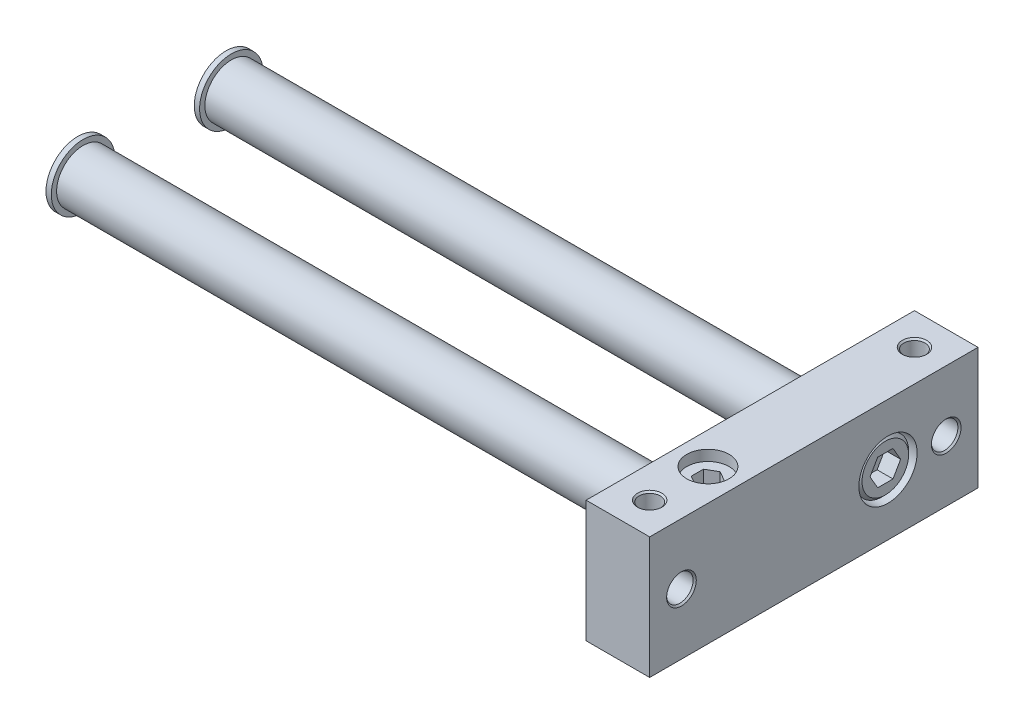
from build123d import *

# Parameters (mm, degrees)
PLATE_SKETCH_W               = 62
PLATE_SKETCH_H               = 23
PLATE_DEPTH                  = 12
TAPPED_HOLE_FACE_D           = 5
TAPPED_HOLE_FACE_CSINK_D     = 5.6
TAPPED_HOLE_FACE_CSINK_ANGLE = 90
RODS_DEPTH                   = 100
RODS_DEPTH_BACK              = 24
RODS_SKETCH_R                = 5
PISTON_SKETCH_R              = 6
PISTON_DEPTH                 = 1
TAPPED_HOLES_TOP_AT_2_COUNT  = 2
TAPPED_HOLES_TOP_AT_2_PITCH  = 50
SHCS_SEAT_SKETCH_R           = 5.5
SHCS_SEAT_DEPTH              = 6.5
SHCS_HEAD_SKETCH_R           = 5
SHCS_HEAD_DEPTH              = 6
SHCS_HEX_DEPTH               = 3
SHCS_CHAM_SIZE               = 0.6
SS_SEAT_SKETCH_R             = 4
SS_SEAT_DEPTH                = 2
SS_HEX_DEPTH                 = 4


with BuildPart() as part:
    # Plate_Sketch → Plate (new body)
    with BuildSketch(Plane(origin=(0, 0, 0), x_dir=(0, 0, -1), z_dir=(1, 0, 0))):
        Rectangle(PLATE_SKETCH_W, PLATE_SKETCH_H)
    extrude(amount=PLATE_DEPTH)

    # Tapped Hole Face (through all)
    with Locations(Plane(origin=(12, 0, 0), x_dir=(0, 0, -1), z_dir=(1, 0, 0))):
        with Locations((-25, 0), (25, 0)):
            CounterSinkHole(TAPPED_HOLE_FACE_D / 2, TAPPED_HOLE_FACE_CSINK_D / 2, counter_sink_angle=TAPPED_HOLE_FACE_CSINK_ANGLE)

    # Rods_Sketch → Rods (add, two sides: drawn at the far end of the back side and taken through both)
    with BuildSketch(Plane.ZY.offset(12).offset(-RODS_DEPTH_BACK)):
        with Locations((-14, 0)):
            Circle(RODS_SKETCH_R)
        with Locations(Location((14, 0, 0), (0, 0, 180))):
            Circle(RODS_SKETCH_R)
    extrude(amount=RODS_DEPTH + RODS_DEPTH_BACK)

    # Piston_Sketch → Piston (add)
    with BuildSketch(Plane.ZY.offset(112)):
        with Locations((-14, 0)):
            Circle(PISTON_SKETCH_R)
        with Locations((14, 0)):
            Circle(PISTON_SKETCH_R)
    extrude(amount=PISTON_DEPTH)

    # Tapped Holes Top Profile → Tapped Holes Top (revolve, cut)
    with BuildSketch(Plane(origin=(6, 11.5, -25), x_dir=(0, 0, 1), z_dir=(1, 0, 0))):
        Polygon((0, 0), (0, 6.499755867), (1.7, 6.2), (1.7, 6), (2, 6), (2, 0.3), (2.3, 0), align=None)
    tapped_holes_top = revolve(axis=Axis((6, 17.85, -25), (0, -1, 0)), mode=Mode.SUBTRACT)

    # Tapped Holes Top at 2: Tapped Holes Top ×2
    with Locations(*[(0, 0, i * TAPPED_HOLES_TOP_AT_2_PITCH) for i in range(1, TAPPED_HOLES_TOP_AT_2_COUNT)]):
        add(tapped_holes_top, mode=Mode.SUBTRACT)

    # Tapped Holes Top Mirror: Tapped Holes Top across plane
    add(tapped_holes_top.mirror(Plane.ZX), mode=Mode.SUBTRACT)

    # Tapped Holes Top Mirror copy 1 sketch → Tapped Holes Top Mirror copy 1 (revolve, cut)
    with BuildSketch(Plane(origin=(6, -11.5, 25), x_dir=(0, 0, 1), z_dir=(1, 0, 0))):
        Polygon((0, 0), (0, -6.499755867), (1.7, -6.2), (1.7, -6), (2, -6), (2, -0.3), (2.3, 0), align=None)
    revolve(axis=Axis((6, -17.85, 25), (0, -1, 0)), mode=Mode.SUBTRACT)

    # SHCS Seat_Sketch → SHCS Seat (cut)
    with BuildSketch(Plane(origin=(12, 0, 0), x_dir=(0, 0, -1), z_dir=(1, 0, 0))):
        with Locations((14, 0)):
            Circle(SHCS_SEAT_SKETCH_R)
    extrude(amount=-SHCS_SEAT_DEPTH, mode=Mode.SUBTRACT)

    # SHCS Head_Sketch → SHCS Head (add)
    with BuildSketch(Plane(origin=(5.5, 0, 0), x_dir=(0, 0, -1), z_dir=(1, 0, 0))):
        with Locations(Location((14, 0, 0), (0, 0, 180))):
            Circle(SHCS_HEAD_SKETCH_R)
    extrude(amount=SHCS_HEAD_DEPTH)

    # SHCS Hex_Sketch → SHCS Hex (cut)
    with BuildSketch(Plane(origin=(11.5, 0, 0), x_dir=(0, 0, -1), z_dir=(1, 0, 0))):
        Polygon((15.443375673, -2.5), (16.886751346, 0), (15.443375673, 2.5), (12.556624327, 2.5), (11.113248654, 0), (12.556624327, -2.5), align=None)
    extrude(amount=-SHCS_HEX_DEPTH, mode=Mode.SUBTRACT)

    # SHCS Cham
    shcs_cham_edges = [part.edges().sort_by_distance(p)[0] for p in [
        (11.5, 0, -19),
    ]]
    chamfer(shcs_cham_edges, length=SHCS_CHAM_SIZE)

    # SS Seat_Sketch → SS Seat (cut)
    with BuildSketch(Plane(origin=(0, 11.5, 0), x_dir=(-1, 0, 0), z_dir=(0, 1, 0))):
        with Locations(Location((-6, 14, 0), (0, 0, 90))):
            Circle(SS_SEAT_SKETCH_R)
    extrude(amount=-SS_SEAT_DEPTH, mode=Mode.SUBTRACT)

    # SS Hex_Sketch → SS Hex (cut)
    with BuildSketch(Plane(origin=(0, 9.5, 0), x_dir=(-1, 0, 0), z_dir=(0, 1, 0))):
        Polygon((-8, 12.845299462), (-6, 11.690598923), (-4, 12.845299462), (-4, 15.154700538), (-6, 16.309401077), (-8, 15.154700538), align=None)
    extrude(amount=-SS_HEX_DEPTH, mode=Mode.SUBTRACT)


solid = part.part
